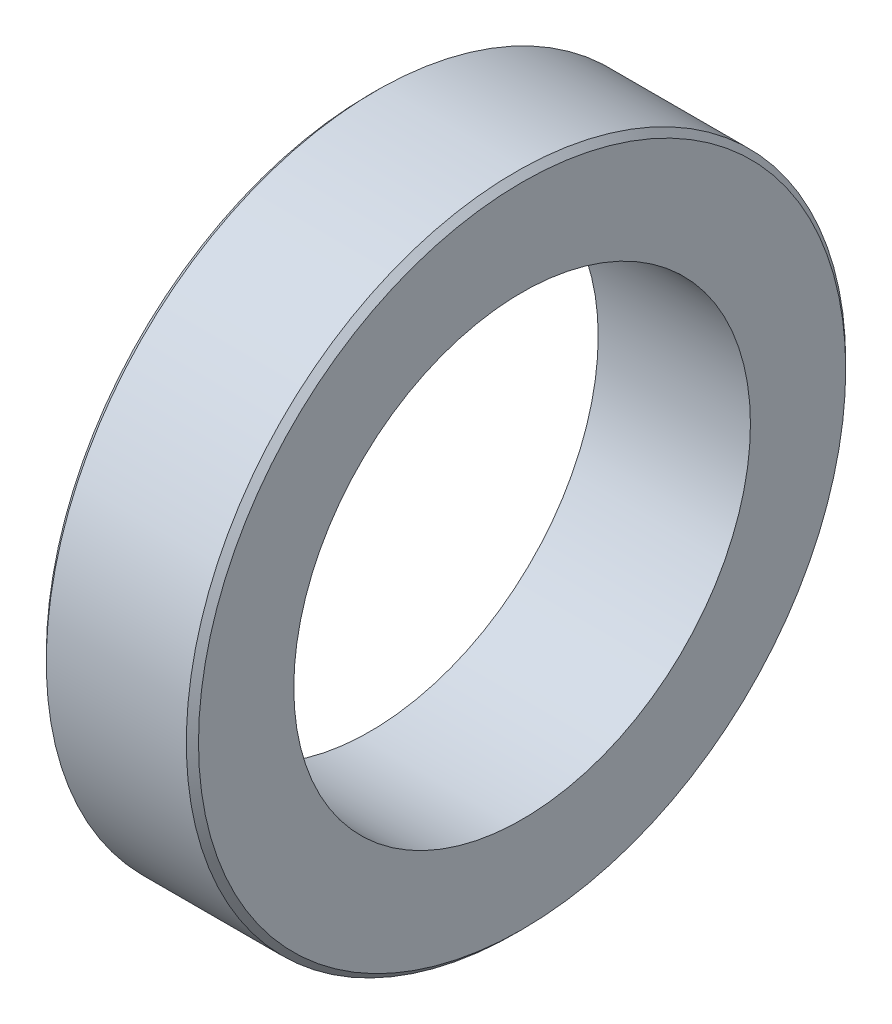
from build123d import *

# Parameters (mm, degrees)
SKETCH1_R           = 82.5246
BOSS_EXTRUDE1_DEPTH = 38.1
SKETCH2_R           = 57.15
CUT_EXTRUDE1_DEPTH  = 38.1
CHAMFER1_SIZE       = 1.524


with BuildPart() as part:
    # Sketch1 → Boss-Extrude1 (new body)
    with BuildSketch(Plane.YZ):
        with Locations(Location((0, 0, 0), (0, 0, 270))):
            Circle(SKETCH1_R)
    extrude(amount=BOSS_EXTRUDE1_DEPTH)

    # Sketch2 → Cut-Extrude1 (cut)
    with BuildSketch(Plane.YZ):
        with Locations(Location((0, 0, 0), (0, 0, 270))):
            Circle(SKETCH2_R)
    extrude(amount=CUT_EXTRUDE1_DEPTH, mode=Mode.SUBTRACT)

    # Chamfer1
    chamfer1_edges = [part.edges().sort_by_distance(p)[0] for p in [
        (0, 0, 82.5246),
        (38.1, 0, 82.5246),
    ]]
    chamfer(chamfer1_edges, length=CHAMFER1_SIZE)


solid = part.part
